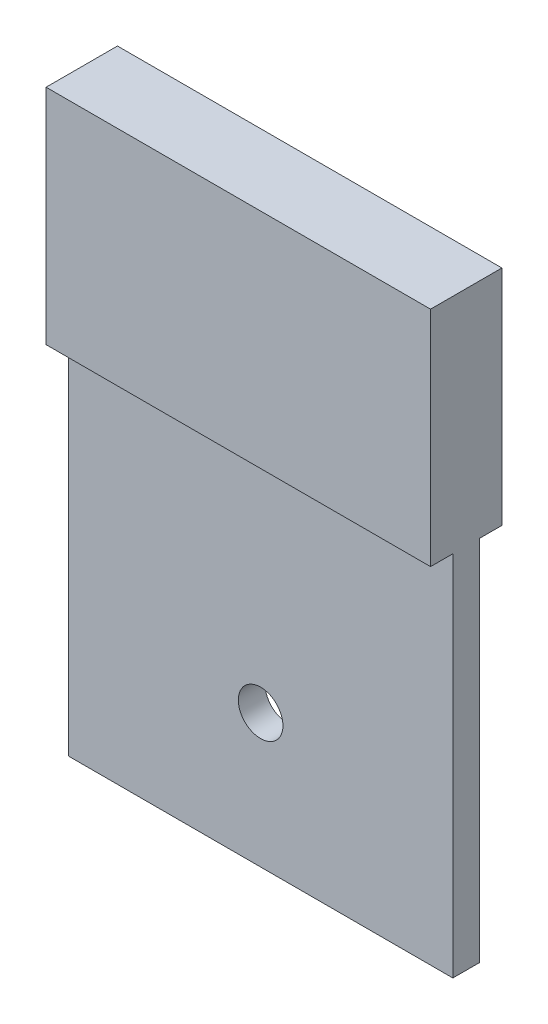
from build123d import *

# Parameters (mm, degrees)
SKETCH1_W           = 86.202021521
SKETCH1_H           = 82.381948497
SKETCH1_R           = 5
BOSS_EXTRUDE1_DEPTH = 6
BOSS_EXTRUDE2_DEPTH = 50


with BuildPart() as part:
    # Sketch1 → Boss-Extrude1 (new body)
    with BuildSketch(Plane.XY):
        with Locations((-54.060241917, 22.740820087)):
            Rectangle(SKETCH1_W, SKETCH1_H)
        with Locations((-54.060241916, 11.48296308)):
            Circle(SKETCH1_R, mode=Mode.SUBTRACT)
    extrude(amount=BOSS_EXTRUDE1_DEPTH)

    # Sketch2 → Boss-Extrude2 (add)
    with BuildSketch(Plane(origin=(0, 63.931794335, 0), x_dir=(1, 0, 0), z_dir=(0, 1, 0))):
        Polygon((-97.161252677, -6), (-97.161252677, -11), (-10.959231156, -11), (-10.959231156, 5), (-97.161252677, 5), align=None)
    extrude(amount=BOSS_EXTRUDE2_DEPTH)


solid = part.part
